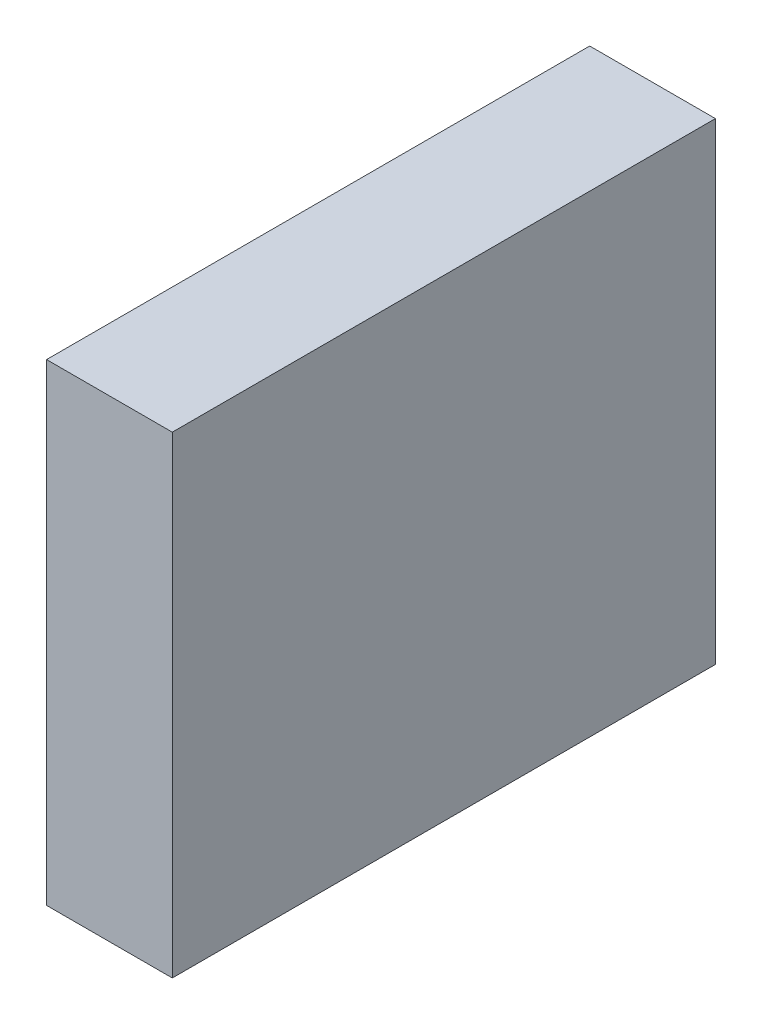
from build123d import *

# Parameters (mm, degrees)
SKETCH_1_W      = 25
SKETCH_1_H      = 94
EXTRUDE_1_DEPTH = 108
SHELL_2_T       = 4


with BuildPart() as part:
    # 草图1 → 凸台-拉伸1 (new body)
    with BuildSketch(Plane.XY):
        with Locations((12.5, 47)):
            Rectangle(SKETCH_1_W, SKETCH_1_H)
    extrude(amount=EXTRUDE_1_DEPTH)

    # 抽壳2 (no face opened: a closed hollow body)
    add(offset(amount=-SHELL_2_T, mode=Mode.PRIVATE), mode=Mode.SUBTRACT)


solid = part.part
